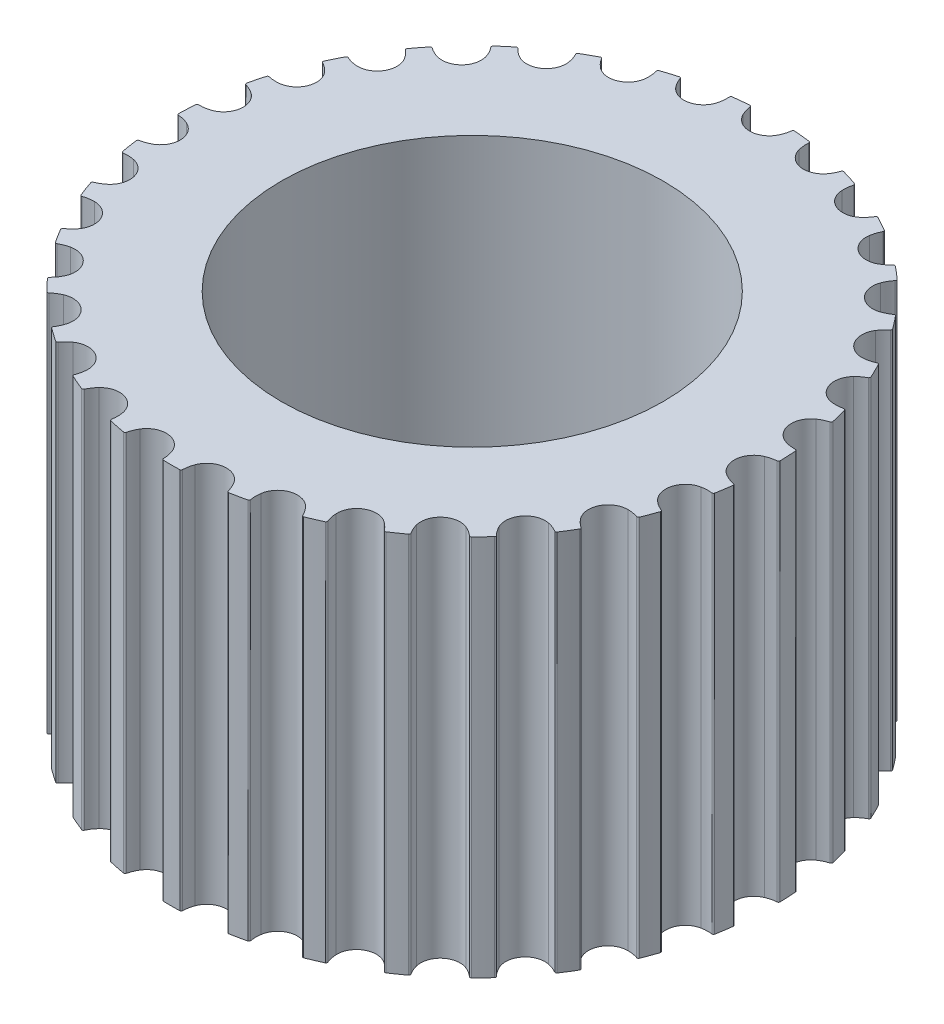
from build123d import *

# Parameters (mm, degrees)
SKETCH1_R           = 10
SKETCH1_R_2         = 6.35
BOSS_EXTRUDE1_DEPTH = 6.35
CUT_EXTRUDE1_DEPTH  = 20.007630047
CIRPATTERN1_COUNT   = 31


with BuildPart() as part:
    # Sketch1 → Boss-Extrude1 (new, symmetric)
    with BuildSketch(Plane(origin=(0, 0, 0), x_dir=(1, 0, 0), z_dir=(0, 1, 0))):
        with Locations(Location((0, 0, 0), (0, 0, 270))):
            Circle(SKETCH1_R)
        with Locations(Location((0, 0, 0), (0, 0, 270))):
            Circle(SKETCH1_R_2, mode=Mode.SUBTRACT)
    extrude(amount=BOSS_EXTRUDE1_DEPTH, both=True)

    # Sketch2 → Cut-Extrude1 (cut, through all)
    with BuildSketch(Plane(origin=(0, 6.35, 0), x_dir=(1, 0, 0), z_dir=(0, 1, 0))):
        with BuildLine():
            ThreePointArc((0.690602581, 9.929091134), (0.707206401, 9.960159866), (0.740175425, 9.972569395))
            ThreePointArc((0.740175425, 9.972569395), (0, 10), (-0.740175425, 9.972569395))
            ThreePointArc((-0.740175425, 9.972569395), (-0.707206401, 9.960159866), (-0.690602581, 9.929091134))
            ThreePointArc((-0.690602581, 9.929091134), (-0.653372886, 9.755701026), (-0.588764045, 9.590546923))
            ThreePointArc((-0.588764045, 9.590546923), (0, 9.222569395), (0.588764045, 9.590546923))
            ThreePointArc((0.588764045, 9.590546923), (0.653372886, 9.755701026), (0.690602581, 9.929091134))
        make_face()
    cut_extrude1 = extrude(amount=-CUT_EXTRUDE1_DEPTH, mode=Mode.SUBTRACT)

    # CirPattern1: Cut-Extrude1 ×31 about axis
    cirpattern1_axis = Axis((0, 0, 0), (0, 1, 0))
    for i in range(1, CIRPATTERN1_COUNT):
        add(cut_extrude1.rotate(cirpattern1_axis, i * 360 / CIRPATTERN1_COUNT), mode=Mode.SUBTRACT)


solid = part.part
